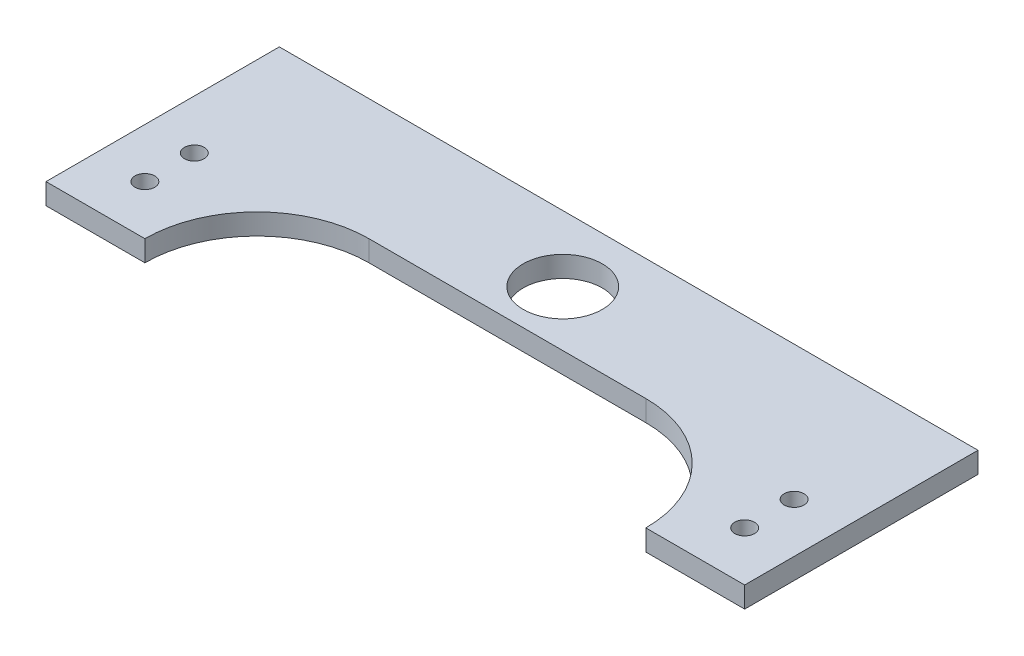
from build123d import *

# Parameters (mm, degrees)
BOSS_EXTRUDE1_DEPTH = 3.175
SKETCH3_R           = 1.5
CUT_EXTRUDE2_DEPTH  = 112.800002795


with BuildPart() as part:
    # Sketch1 → Boss-Extrude1 (new body)
    with BuildSketch(Plane(origin=(0, 0, 0), x_dir=(1, 0, 0), z_dir=(0, 1, 0))):
        with BuildLine():
            ThreePointArc((59, 25.4), (57.242640687, 21.157359313), (53, 19.4))
            Line((53, 19.4), (53, 17.4))
            Line((53, 17.4), (53, 17))
            Line((53, 17), (74, 17))
            Line((74, 17), (91, 17))
            ThreePointArc((91, 17), (99.746427842, 14.577379737), (106, 8))
            Line((106, 8), (106, 35.4))
            Line((106, 35.4), (53, 35.4))
            Line((53, 35.4), (53, 31.4))
            ThreePointArc((53, 31.4), (57.242640687, 29.642640687), (59, 25.4))
        make_face()
        with BuildLine():
            ThreePointArc((106, 8), (99.746427842, 14.577379737), (91, 17))
            Line((91, 17), (91, 0))
            Line((91, 0), (106, 0))
            Line((106, 0), (106, 8))
        make_face()
        with BuildLine():
            Line((91, 0), (91, 17))
            ThreePointArc((91, 17), (86.600076233, 16.420739047), (82.5, 14.722431864))
            ThreePointArc((82.5, 14.722431864), (88.722431864, 8.5), (91, 0))
        make_face()
        with BuildLine():
            Line((91, 17), (74, 17))
            ThreePointArc((74, 17), (78.399923767, 16.420739047), (82.5, 14.722431864))
            ThreePointArc((82.5, 14.722431864), (86.600076233, 16.420739047), (91, 17))
        make_face()
        with BuildLine():
            Line((53, 17.4), (53, 19.4))
            ThreePointArc((53, 19.4), (47, 25.4), (53, 31.4))
            Line((53, 31.4), (53, 35.4))
            Line((53, 35.4), (0, 35.4))
            Line((0, 35.4), (0, 8))
            ThreePointArc((0, 8), (6.253572158, 14.577379737), (15, 17))
            Line((15, 17), (32, 17))
            Line((32, 17), (53, 17))
            Line((53, 17), (53, 17.4))
        make_face()
        with BuildLine():
            Line((15, 0), (15, 17))
            ThreePointArc((15, 17), (6.253572158, 14.577379737), (0, 8))
            Line((0, 8), (0, 0))
            Line((0, 0), (15, 0))
        make_face()
        with BuildLine():
            ThreePointArc((23.5, 14.722431864), (19.399923767, 16.420739047), (15, 17))
            Line((15, 17), (15, 0))
            ThreePointArc((15, 0), (17.277568136, 8.5), (23.5, 14.722431864))
        make_face()
        with BuildLine():
            ThreePointArc((23.5, 14.722431864), (27.600076233, 16.420739047), (32, 17))
            Line((32, 17), (15, 17))
            ThreePointArc((15, 17), (19.399923767, 16.420739047), (23.5, 14.722431864))
        make_face()
    extrude(amount=BOSS_EXTRUDE1_DEPTH)

    # Sketch3 → Cut-Extrude2 (cut, through all)
    with BuildSketch(Plane.XZ):
        with BuildLine():
            ThreePointArc((9, -15), (8.560660172, -13.939339828), (7.5, -13.5))
            Line((7.5, -13.5), (7.5, -16.5))
            ThreePointArc((7.5, -16.5), (8.560660172, -16.060660172), (9, -15))
        make_face()
        with BuildLine():
            Line((7.5, -16.5), (7.5, -13.5))
            ThreePointArc((7.5, -13.5), (6, -15), (7.5, -16.5))
        make_face()
        with Locations(Location((98.5, -15, 0), (0, 0, 270))):
            Circle(SKETCH3_R)
        with Locations(Location((98.5, -7.5, 0), (0, 0, 270))):
            Circle(SKETCH3_R)
        with Locations(Location((7.5, -7.5, 0), (0, 0, 270))):
            Circle(SKETCH3_R)
    extrude(amount=-CUT_EXTRUDE2_DEPTH, mode=Mode.SUBTRACT)


solid = part.part
